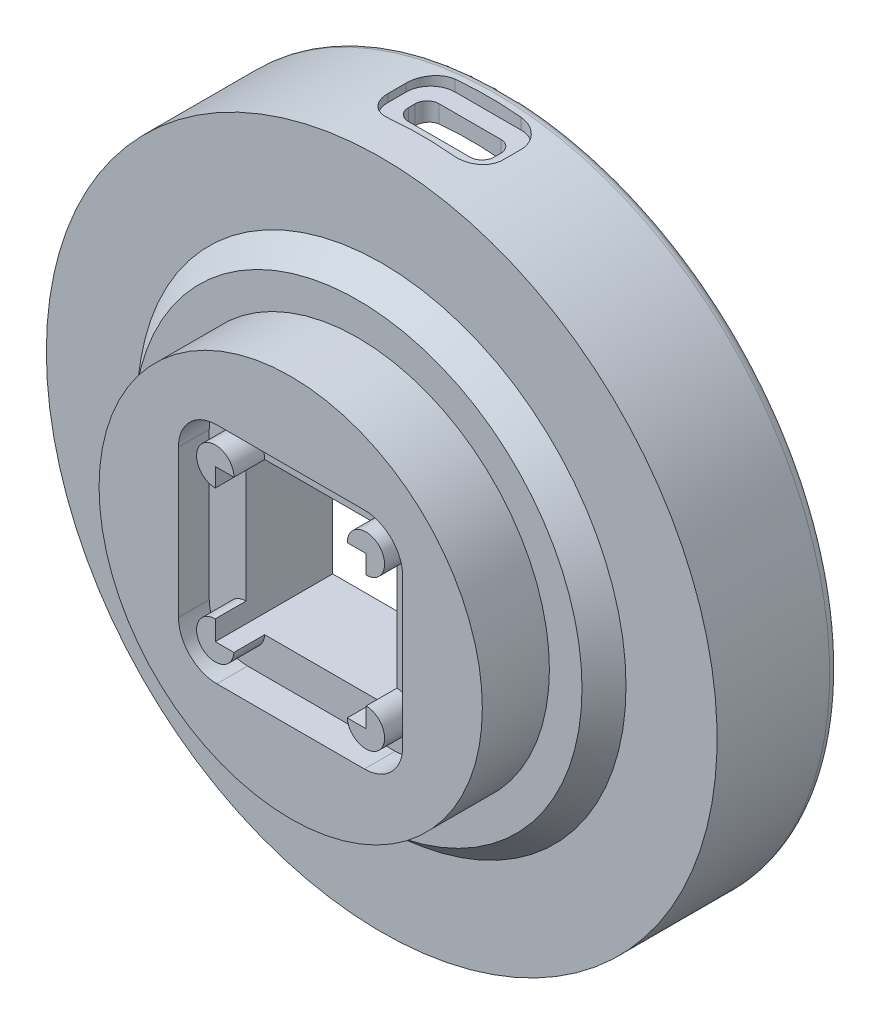
from build123d import *

# Parameters (mm, degrees)
SKETCH_2_R               = 20
EXTRUDE_1_DEPTH          = 10
CUT_EXTRUDE_START        = -3.21
SKETCH_3_R               = 1.95
CUT_EXTRUDE_1_DEPTH      = 3.21
SKETCH_4_R               = 1.95
EXTRUDE_2_DEPTH          = 3.21
EXTRUDE_5_DEPTH          = 12.25
EXTRUDE_5_DEPTH_BACK     = 0.5
SKETCH_11_R              = 35
SKETCH_14_R              = 32
CUT_EXTRUDE_3_DEPTH      = 10
SKETCH_15_R              = 33
CUT_EXTRUDE_4_DEPTH      = 2
CUT_EXTRUDE_5_DEPTH      = 10
CUT_EXTRUDE_6_DEPTH      = 2
CUT_EXTRUDE_6_DEPTH_BACK = 2
EXTRUDE_6_DEPTH          = 2
EXTRUDE_9_DEPTH          = 3.362823
CUT_EXTRUDE_8_DEPTH      = 5
SKETCH_25_W              = 15.740658342
SKETCH_25_H              = 15.835096482
CUT_EXTRUDE_9_DEPTH      = 15
SKETCH_26_W              = 1.494943783
SKETCH_26_H              = 11.950704804
SKETCH_26_W_2            = 1.529951567
SKETCH_26_H_2            = 13.623803476
SKETCH_26_W_3            = 4.74456779
SKETCH_26_H_3            = 1.568493223
SKETCH_26_W_4            = 7.014486442
SKETCH_26_H_4            = 1.553492486
EXTRUDE_10_DEPTH         = 8
SKETCH_28_W              = 5.367346996
SKETCH_28_H              = 7.839151532
EXTRUDE_11_DEPTH         = 2
SKETCH_29_W              = 1.7
SKETCH_29_H              = 12.872442774
SKETCH_29_H_2            = 12.7
SKETCH_29_W_2            = 5.781613905
SKETCH_29_H_3            = 1.733367437
EXTRUDE_12_DEPTH         = 3.25
SKETCH_30_W              = 1.544752331
SKETCH_30_H              = 5
SKETCH_30_W_2            = 4.319710911
SKETCH_30_H_2            = 1.632346374
SKETCH_30_W_3            = 3.974629604
SKETCH_30_H_3            = 1.690917675
EXTRUDE_13_DEPTH         = 1.6
CUT_EXTRUDE_11_DEPTH     = 5
SKETCH_33_R              = 2.975
SKETCH_33_R_2            = 1.475
EXTRUDE_15_DEPTH         = 4
FILLET_1_R               = 1


with BuildPart() as part:
    # 草图2 → 凸台-拉伸1 (new body)
    with BuildSketch(Plane.XY):
        Circle(SKETCH_2_R)
    extrude(amount=-EXTRUDE_1_DEPTH)

    # 草图3 → 切除-拉伸1 (cut)
    with BuildSketch(Plane.XY.offset(CUT_EXTRUDE_START)):
        with BuildLine():
            Line((-7.710329171, 11.757548241), (7.689670829, 11.757548241))
            ThreePointArc((7.689670829, 11.757548241), (10.518097953, 10.585975365), (11.689670829, 7.757548241))
            Line((11.689670829, 7.757548241), (11.689670829, -7.642451759))
            ThreePointArc((11.689670829, -7.642451759), (10.518097953, -10.470878884), (7.689670829, -11.642451759))
            Line((7.689670829, -11.642451759), (-7.710329171, -11.642451759))
            ThreePointArc((-7.710329171, -11.642451759), (-10.538756296, -10.470878884), (-11.710329171, -7.642451759))
            Line((-11.710329171, -7.642451759), (-11.710329171, 7.757548241))
            ThreePointArc((-11.710329171, 7.757548241), (-10.538756296, 10.585975365), (-7.710329171, 11.757548241))
        make_face()
        with Locations((7.849670829, -7.802451759)):
            Circle(SKETCH_3_R, mode=Mode.SUBTRACT)
        with Locations((7.849670829, 7.917548241)):
            Circle(SKETCH_3_R, mode=Mode.SUBTRACT)
        with Locations((-7.870329171, 7.917548241)):
            Circle(SKETCH_3_R, mode=Mode.SUBTRACT)
        with Locations((-7.870329171, -7.802451759)):
            Circle(SKETCH_3_R, mode=Mode.SUBTRACT)
    extrude(amount=CUT_EXTRUDE_1_DEPTH, mode=Mode.SUBTRACT)

    # 草图4 → 凸台-拉伸2 (add)
    with BuildSketch(Plane(origin=(0, 0, -3.21), x_dir=(-1, 0, 0), z_dir=(0, 0, -1))):
        with Locations(Location((7.870329171, 7.917548241, 0), (0, 0, 180))):
            Circle(SKETCH_4_R)
        with Locations(Location((7.870329171, -7.802451759, 0), (0, 0, 180))):
            Circle(SKETCH_4_R)
        with Locations(Location((-7.849670829, -7.802451759, 0), (0, 0, 180))):
            Circle(SKETCH_4_R)
        with Locations(Location((-7.849670829, 7.917548241, 0), (0, 0, 180))):
            Circle(SKETCH_4_R)
    extrude(amount=-EXTRUDE_2_DEPTH)

    # 草图10 → 旋转1 (revolve)
    with BuildSketch(Plane(origin=(0, 0, 0), x_dir=(1, 0, 0), z_dir=(0, 1, 0)), mode=Mode.PRIVATE) as revolve_1_sk:
        Polygon((-20, 7), (-23.400893257, 7), (-25.912132034, 10), (-23.400893257, 10), (-20, 10), align=None)
    revolve(revolve_1_sk.sketch.rotate(Axis((0, 0, 0), (0, 0, -1)), 180), axis=Axis((0, 0, 0), (0, 0, -1)))

    # 草图11 → 凸台-拉伸5 (add, two sides: drawn at the far end of the back side and taken through both)
    with BuildSketch(Plane(origin=(0, 0, -10), x_dir=(-1, 0, 0), z_dir=(0, 0, -1)).offset(-EXTRUDE_5_DEPTH_BACK)):
        Circle(SKETCH_11_R)
    extrude(amount=EXTRUDE_5_DEPTH + EXTRUDE_5_DEPTH_BACK)

    # 草图14 → 切除-拉伸3 (cut)
    with BuildSketch(Plane(origin=(0, 0, -22.25), x_dir=(-1, 0, 0), z_dir=(0, 0, -1))):
        Circle(SKETCH_14_R)
    extrude(amount=-CUT_EXTRUDE_3_DEPTH, mode=Mode.SUBTRACT)

    # 草图15 → 切除-拉伸4 (cut)
    with BuildSketch(Plane(origin=(0, 0, -22.25), x_dir=(-1, 0, 0), z_dir=(0, 0, -1))):
        Circle(SKETCH_15_R)
    extrude(amount=-CUT_EXTRUDE_4_DEPTH, mode=Mode.SUBTRACT)

    # 草图18 → 切除-拉伸5 (cut)
    with BuildSketch(Plane(origin=(0, 33.669137751, 0), x_dir=(1, 0, 0), z_dir=(0, 1, 0))):
        with BuildLine():
            Line((-3.446221995, 13.605), (3.446221995, 13.605))
            ThreePointArc((3.446221995, 13.605), (5.25201574, 14.35298426), (6, 16.158778005))
            Line((6, 16.158778005), (6, 18.051221995))
            ThreePointArc((6, 18.051221995), (5.25201574, 19.85701574), (3.446221995, 20.605))
            Line((3.446221995, 20.605), (-3.446221995, 20.605))
            ThreePointArc((-3.446221995, 20.605), (-5.25201574, 19.85701574), (-6, 18.051221995))
            Line((-6, 18.051221995), (-6, 16.158778005))
            ThreePointArc((-6, 16.158778005), (-5.25201574, 14.35298426), (-3.446221995, 13.605))
        make_face()
    extrude(amount=CUT_EXTRUDE_5_DEPTH, mode=Mode.SUBTRACT)

    # 草图19 → 切除-拉伸6 (cut, two sides: drawn at the far end of the back side and taken through both)
    with BuildSketch(Plane(origin=(0, 32.169137751, 0), x_dir=(1, 0, 0), z_dir=(0, 1, 0)).offset(-CUT_EXTRUDE_6_DEPTH_BACK)):
        with BuildLine():
            Line((-4.47, 16.75), (-4.47, 17.46))
            ThreePointArc((-4.47, 17.46), (-4.103883476, 18.343883477), (-3.22, 18.71))
            Line((-3.22, 18.71), (3.22, 18.71))
            ThreePointArc((3.22, 18.71), (4.103883476, 18.343883477), (4.47, 17.46))
            Line((4.47, 17.46), (4.47, 16.75))
            ThreePointArc((4.47, 16.75), (4.103883476, 15.866116524), (3.22, 15.5))
            Line((3.22, 15.5), (-3.22, 15.5))
            ThreePointArc((-3.22, 15.5), (-4.103883476, 15.866116524), (-4.47, 16.75))
        make_face()
    extrude(amount=CUT_EXTRUDE_6_DEPTH + CUT_EXTRUDE_6_DEPTH_BACK, mode=Mode.SUBTRACT)

    # 草图21 → 凸台-拉伸6 (add)
    with BuildSketch(Plane(origin=(0, 0, -12.25), x_dir=(-1, 0, 0), z_dir=(0, 0, -1))):
        Polygon((14.199016708, 7.776342203), (12.096695943, 10.938180832), (10.737208588, 10.034251558), (12.839529353, 6.872412929), align=None)
        Polygon((13.985003259, 13.648868589), (12.145919532, 12.426053524), (11.303680645, 13.692760058), (13.142764371, 14.915575122), align=None)
        Polygon((17.307106622, 8.652506988), (15.359059322, 7.357241551), (16.34390314, 5.876060715), (18.291950441, 7.171326152), align=None)
    extrude(amount=EXTRUDE_6_DEPTH)

    # 草图23 → 凸台-拉伸9 (add)
    with BuildSketch(Plane(origin=(0, 0, -12.25), x_dir=(-1, 0, 0), z_dir=(0, 0, -1))):
        Polygon((25.266454267, 12.360086641), (20.660534392, 19.463438627), (16.624004022, 16.846091845), (21.229923897, 9.742739859), align=None)
    extrude(amount=EXTRUDE_9_DEPTH)

    # 草图24 → 切除-拉伸8 (cut)
    with BuildSketch(Plane(origin=(-23.429974487, 15.192346569, 0), x_dir=(0, 0, 1), z_dir=(-0.8390507857009022, 0.5440531031201816, 0))):
        with BuildLine():
            Line((-14.049608608, 3.064207836), (-14.049608608, -1.009093434))
            add(Edge.make_bspline(
                [(-14.049608608, -1.009093434), (-14.049608608, -1.418314787), (-14.218081041, -1.825016223), (-14.796845842, -2.40374261), (-15.203574273, -2.572203861), (-15.612822788, -2.572203861)],
                knots=[0, 0, 0, 0, 0.5, 0.5, 1, 1, 1, 1], degree=3))
            Line((-15.612822788, -2.572203861), (-15.612822788, 4.627318263))
            add(Edge.make_bspline(
                [(-15.612822788, 4.627318263), (-15.203574273, 4.627318263), (-14.796845842, 4.458857013), (-14.218081041, 3.880130625), (-14.049608608, 3.473429189), (-14.049608608, 3.064207836)],
                knots=[0, 0, 0, 0, 0.5, 0.5, 1, 1, 1, 1], degree=3))
        make_face()
    extrude(amount=-CUT_EXTRUDE_8_DEPTH, mode=Mode.SUBTRACT)

    # 草图25 → 切除-拉伸9 (cut)
    with BuildSketch(Plane.XY):
        Rectangle(SKETCH_25_W, SKETCH_25_H)
    extrude(amount=-CUT_EXTRUDE_9_DEPTH, mode=Mode.SUBTRACT)

    # 草图26 → 凸台-拉伸10 (add)
    with BuildSketch(Plane(origin=(0, 0, -12.25), x_dir=(-1, 0, 0), z_dir=(0, 0, -1))):
        Polygon((9.744130588, -20.921254797), (-6.269813848, -20.861037188), (-6.275664277, -22.416868439), (9.738280159, -22.477086047), align=None)
        with Locations((-19.982694769, -9.269317614)):
            Rectangle(SKETCH_26_W, SKETCH_26_H)
        with Locations((21.529752907, -8.432768278)):
            Rectangle(SKETCH_26_W_2, SKETCH_26_H_2)
        with Locations((10.242613066, 4.923209424)):
            Rectangle(SKETCH_26_W_3, SKETCH_26_H_3)
        with Locations((-11.377572392, 4.915709055)):
            Rectangle(SKETCH_26_W_4, SKETCH_26_H_4)
    extrude(amount=EXTRUDE_10_DEPTH)

    # 草图28 → 凸台-拉伸11 (add)
    with BuildSketch(Plane(origin=(0, 0, -12.25), x_dir=(-1, 0, 0), z_dir=(0, 0, -1))):
        with Locations((1.789299339, 18.227729585)):
            Rectangle(SKETCH_28_W, SKETCH_28_H)
    extrude(amount=EXTRUDE_11_DEPTH)

    # 草图29 → 凸台-拉伸12 (add)
    with BuildSketch(Plane(origin=(0, 0, -12.25), x_dir=(-1, 0, 0), z_dir=(0, 0, -1))):
        with Locations((9.747325992, 20.187377988)):
            Rectangle(SKETCH_29_W, SKETCH_29_H)
        with Locations((-9.732674008, 20.101156601)):
            Rectangle(SKETCH_29_W, SKETCH_29_H_2)
        with Locations((3.315495595, 8.820472883)):
            Rectangle(SKETCH_29_W_2, SKETCH_29_H_3)
    extrude(amount=EXTRUDE_12_DEPTH)

    # 草图30 → 凸台-拉伸13 (add)
    with BuildSketch(Plane(origin=(0, 0, -12.25), x_dir=(-1, 0, 0), z_dir=(0, 0, -1))):
        with Locations((16.402055041, 23.104914485)):
            Rectangle(SKETCH_30_W, SKETCH_30_H)
        Polygon((-16.629511414, 17.434236314), (-16.640779994, 21.530429014), (-18.373740299, 21.52566166), (-18.362471719, 17.42946896), align=None)
        with Locations((-24.162588507, 13.3623941)):
            Rectangle(SKETCH_30_W_2, SKETCH_30_H_2)
        with Locations((-24.193835066, 5.700762076)):
            Rectangle(SKETCH_30_W_3, SKETCH_30_H_3)
    extrude(amount=EXTRUDE_13_DEPTH)

    # 草图32 → 切除-拉伸11 (cut)
    with BuildSketch(Plane(origin=(-29.695223518, 19.744488054, 0), x_dir=(0, 0, 1), z_dir=(-0.8327269333980879, 0.5536838939263238, 0))):
        with BuildLine():
            Line((-16.737951229, -3.077490577), (-15.538858253, -3.077490577))
            ThreePointArc((-15.538858253, -3.077490577), (-14.414237789, -2.611657528), (-13.948404741, -1.487037064))
            Line((-13.948404741, -1.487037064), (-13.948404741, 2.732055911))
            ThreePointArc((-13.948404741, 2.732055911), (-14.414237789, 3.856676375), (-15.538858253, 4.322509423))
            Line((-15.538858253, 4.322509423), (-16.737951229, 4.322509423))
            ThreePointArc((-16.737951229, 4.322509423), (-17.862571692, 3.856676375), (-18.328404741, 2.732055911))
            Line((-18.328404741, 2.732055911), (-18.328404741, -1.487037064))
            ThreePointArc((-18.328404741, -1.487037064), (-17.862571692, -2.611657528), (-16.737951229, -3.077490577))
        make_face()
    extrude(amount=-CUT_EXTRUDE_11_DEPTH, mode=Mode.SUBTRACT)

    # 草图33 → 凸台-拉伸15 (add)
    # profile 1 of 3: a face of its own
    with BuildSketch(Plane(origin=(0, 0, -12.25), x_dir=(-1, 0, 0), z_dir=(0, 0, -1))):
        with Locations(Location((26.0034734, 9.296556496, 0), (0, 0, 125.765233033))):
            Circle(SKETCH_33_R)
        with Locations((26.0034734, 9.296556496)):
            Circle(SKETCH_33_R_2, mode=Mode.SUBTRACT)
    # profile 2 of 3: a face of its own
    with BuildSketch(Plane(origin=(0, 0, -12.25), x_dir=(-1, 0, 0), z_dir=(0, 0, -1))):
        with Locations((-4.950682607, -27.167946799)):
            Circle(SKETCH_33_R)
        with Locations((-4.950682607, -27.167946799)):
            Circle(SKETCH_33_R_2, mode=Mode.SUBTRACT)
    # profile 3 of 3: a face of its own
    with BuildSketch(Plane(origin=(0, 0, -12.25), x_dir=(-1, 0, 0), z_dir=(0, 0, -1))):
        with Locations(Location((-21.052790793, 17.871390303, 0), (0, 0, 25.482502731))):
            Circle(SKETCH_33_R)
        with Locations((-21.052790793, 17.871390303)):
            Circle(SKETCH_33_R_2, mode=Mode.SUBTRACT)
    extrude(amount=EXTRUDE_15_DEPTH)

    # 圆角1
    fillet_1_edges = [part.edges().sort_by_distance(p)[0] for p in [
        (35, 0, -22.25),
    ]]
    fillet(fillet_1_edges, radius=FILLET_1_R)


solid = part.part
